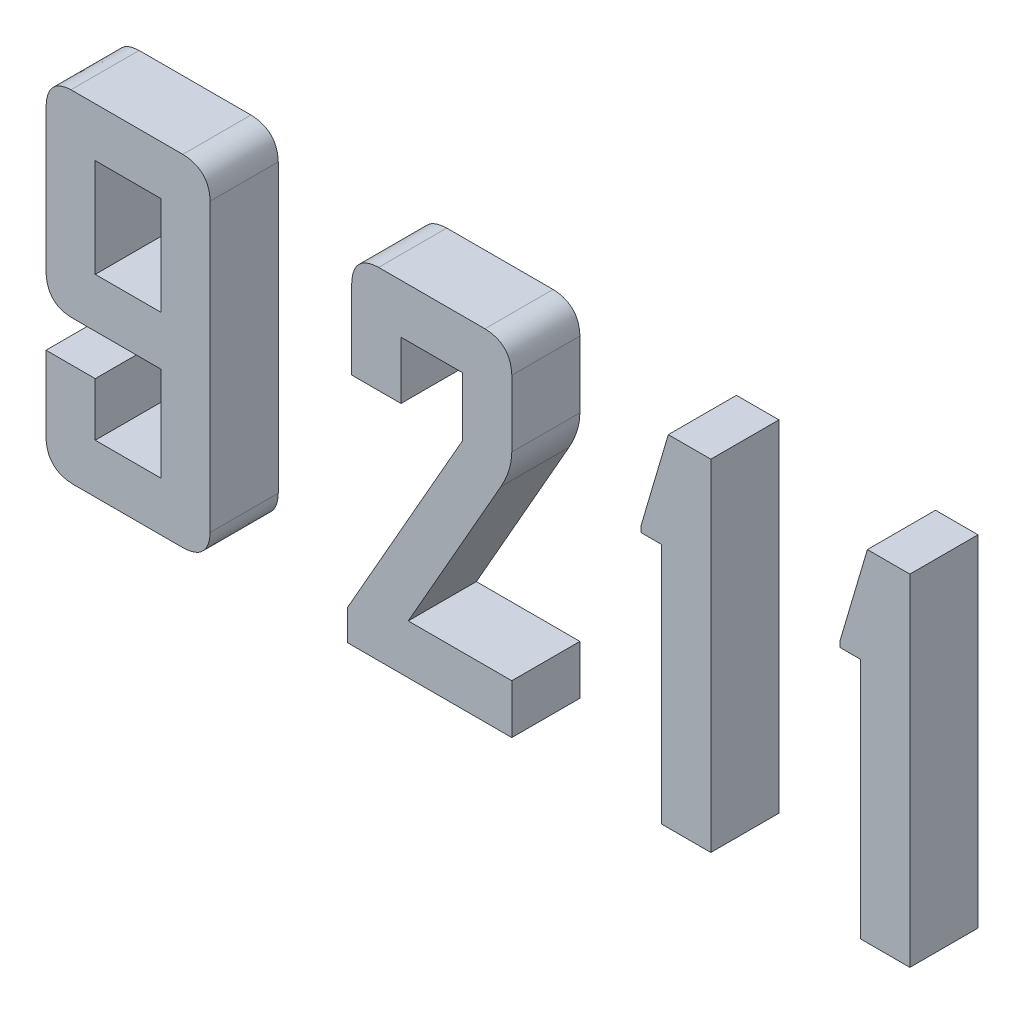
from build123d import *

# Parameters (mm, degrees)
ESQUISSE1_W          = 2.891566265
ESQUISSE1_H          = 4.337349397
BOSS_EXTRU_1_DEPTH   = 3
BOSS_EXTRU_1_2_DEPTH = 3
BOSS_EXTRU_1_3_DEPTH = 3
BOSS_EXTRU_1_4_DEPTH = 3


with BuildPart() as part:
    # Esquisse1 → Boss.-Extru.1 (new body)
    with BuildSketch(Plane.XY):
        with BuildLine():
            add(Edge.make_bspline(
                [(-10.822341088, 1.183170181), (-10.828720555, 1.093284069), (-10.840769922, 0.923509589), (-10.904702475, 0.686823192), (-10.998511354, 0.480984027), (-11.136811645, 0.314470557), (-11.303325115, 0.176170266), (-11.509164281, 0.082361386), (-11.745850677, 0.018428833), (-11.915625157, 0.006379467), (-12.005511269, 0)],
                knots=[0, 0, 0, 0, 1.144701434, 2.162081395, 3.105417678, 4, 4.894582322, 5.837918605, 6.855298566, 8, 8, 8, 8], degree=3))
            Line((-12.005511269, 0), (-16.86808657, 0))
            add(Edge.make_bspline(
                [(-16.86808657, 0), (-16.957972683, 0.006379467), (-17.127747163, 0.018428833), (-17.364433559, 0.082361386), (-17.570272724, 0.176170266), (-17.736786194, 0.314470557), (-17.875086486, 0.480984027), (-17.968895365, 0.686823192), (-18.032827918, 0.923509589), (-18.044877284, 1.093284069), (-18.051256751, 1.183170181)],
                knots=[0, 0, 0, 0, 1.144701434, 2.162081395, 3.105417678, 4, 4.894582322, 5.837918605, 6.855298566, 8, 8, 8, 8], degree=3))
            Line((-18.051256751, 1.183170181), (-18.051256751, 4.518072289))
            Line((-18.051256751, 4.518072289), (-15.882582052, 4.518072289))
            Line((-15.882582052, 4.518072289), (-15.882582052, 2.168674699))
            Line((-15.882582052, 2.168674699), (-12.991015787, 2.168674699))
            Line((-12.991015787, 2.168674699), (-12.991015787, 6.325301205))
            Line((-12.991015787, 6.325301205), (-16.952800426, 6.325301205))
            add(Edge.make_bspline(
                [(-16.952800426, 6.325301205), (-17.036125953, 6.331700682), (-17.193889779, 6.343817088), (-17.413835331, 6.408049405), (-17.605303727, 6.502594974), (-17.760372321, 6.640157977), (-17.885818056, 6.808736458), (-17.975150485, 7.01238261), (-18.031141865, 7.249698818), (-18.044281085, 7.418731329), (-18.051256751, 7.508471386)],
                knots=[0, 0, 0, 0, 1.101013002, 2.084595567, 3.007545748, 3.897505959, 4.795074283, 5.763216275, 6.8124823, 8, 8, 8, 8], degree=3))
            Line((-18.051256751, 7.508471386), (-18.051256751, 13.816829819))
            add(Edge.make_bspline(
                [(-18.051256751, 13.816829819), (-18.044281085, 13.906569876), (-18.031141865, 14.075602387), (-17.975150485, 14.312918595), (-17.885818056, 14.516564747), (-17.760372321, 14.685143228), (-17.605303727, 14.822706231), (-17.413835331, 14.917251799), (-17.193889779, 14.981484117), (-17.036125953, 14.993600523), (-16.952800426, 15)],
                knots=[0, 0, 0, 0, 1.1875177, 2.236783725, 3.204925717, 4.102494041, 4.992454252, 5.915404433, 6.898986998, 8, 8, 8, 8], degree=3))
            Line((-16.952800426, 15), (-12.025277835, 15))
            add(Edge.make_bspline(
                [(-12.025277835, 15), (-11.934501451, 14.993482279), (-11.762058589, 14.981100925), (-11.521172247, 14.918392292), (-11.311879857, 14.822837257), (-11.139949008, 14.687511913), (-11.001317824, 14.518833725), (-10.908232312, 14.312781171), (-10.839791076, 14.076997722), (-10.828375924, 13.906805269), (-10.822341088, 13.816829819)],
                knots=[0, 0, 0, 0, 1.146896384, 2.178695418, 3.124832518, 4.030481977, 4.917543956, 5.852950044, 6.864921545, 8, 8, 8, 8], degree=3))
            Line((-10.822341088, 13.816829819), (-10.822341088, 1.183170181))
        make_face()
        with Locations((-14.43679892, 10.662650603)):
            Rectangle(ESQUISSE1_W, ESQUISSE1_H, mode=Mode.SUBTRACT)
    extrude(amount=BOSS_EXTRU_1_DEPTH)


with BuildPart() as body_2:
    # Esquisse1 → Boss.-Extru.1 2 (new body)
    with BuildSketch(Plane.XY):
        with BuildLine():
            add(Edge.make_bspline(
                [(2.460791442, 10.888554217), (2.454201563, 10.767549242), (2.440495066, 10.515867148), (2.342453685, 10.132064538), (2.193751927, 9.728222162), (2.052001295, 9.464707926), (1.977922466, 9.326995482)],
                knots=[0, 0, 0, 0, 0.878890772, 1.828032848, 2.864930751, 4, 4, 4, 4], degree=3))
            Line((1.977922466, 9.326995482), (-2.099637775, 2.168674699))
            Line((-2.099637775, 2.168674699), (2.460791442, 2.168674699))
            Line((2.460791442, 2.168674699), (2.460791442, 0))
            Line((2.460791442, 0), (-4.768124221, 0))
            Line((-4.768124221, 0), (-4.768124221, 1.355421687))
            Line((-4.768124221, 1.355421687), (0.292116743, 10.239081325))
            Line((0.292116743, 10.239081325), (0.292116743, 12.831325301))
            Line((0.292116743, 12.831325301), (-2.418726631, 12.831325301))
            Line((-2.418726631, 12.831325301), (-2.418726631, 10.301204819))
            Line((-2.418726631, 10.301204819), (-4.587401329, 10.301204819))
            Line((-4.587401329, 10.301204819), (-4.587401329, 13.816829819))
            add(Edge.make_bspline(
                [(-4.587401329, 13.816829819), (-4.581021862, 13.906715931), (-4.568972496, 14.076490411), (-4.505039943, 14.313176808), (-4.411231064, 14.519015973), (-4.272930773, 14.685529443), (-4.106417303, 14.823829734), (-3.900578137, 14.917638614), (-3.663891741, 14.981571167), (-3.494117261, 14.993620533), (-3.404231149, 15)],
                knots=[0, 0, 0, 0, 1.144701434, 2.162081395, 3.105417678, 4, 4.894582322, 5.837918605, 6.855298566, 8, 8, 8, 8], degree=3))
            Line((-3.404231149, 15), (1.277621261, 15))
            add(Edge.make_bspline(
                [(1.277621261, 15), (1.367507373, 14.993620533), (1.537281853, 14.981571167), (1.77396825, 14.917638614), (1.979807415, 14.823829734), (2.146320885, 14.685529443), (2.284621176, 14.519015973), (2.378430055, 14.313176808), (2.442362608, 14.076490411), (2.454411975, 13.906715931), (2.460791442, 13.816829819)],
                knots=[0, 0, 0, 0, 1.144701434, 2.162081395, 3.105417678, 4, 4.894582322, 5.837918605, 6.855298566, 8, 8, 8, 8], degree=3))
            Line((2.460791442, 13.816829819), (2.460791442, 10.888554217))
        make_face()
    extrude(amount=BOSS_EXTRU_1_2_DEPTH)


with BuildPart() as body_3:
    # Esquisse1 → Boss.-Extru.1 3 (new body)
    with BuildSketch(Plane.XY):
        Polygon((11.225851683, 0), (9.057176984, 0), (9.057176984, 10.662650602), (8.153562526, 10.662650602), (8.153562526, 10.93373494), (9.353675478, 15), (11.225851683, 15), align=None)
    extrude(amount=BOSS_EXTRU_1_3_DEPTH)


with BuildPart() as body_4:
    # Esquisse1 → Boss.-Extru.1 4 (new body)
    with BuildSketch(Plane.XY):
        Polygon((19.990911924, 0), (17.822237225, 0), (17.822237225, 10.662650602), (16.918622767, 10.662650602), (16.918622767, 10.93373494), (18.118735719, 15), (19.990911924, 15), align=None)
    extrude(amount=BOSS_EXTRU_1_4_DEPTH)


solid = Compound([part.part, body_2.part, body_3.part, body_4.part])
